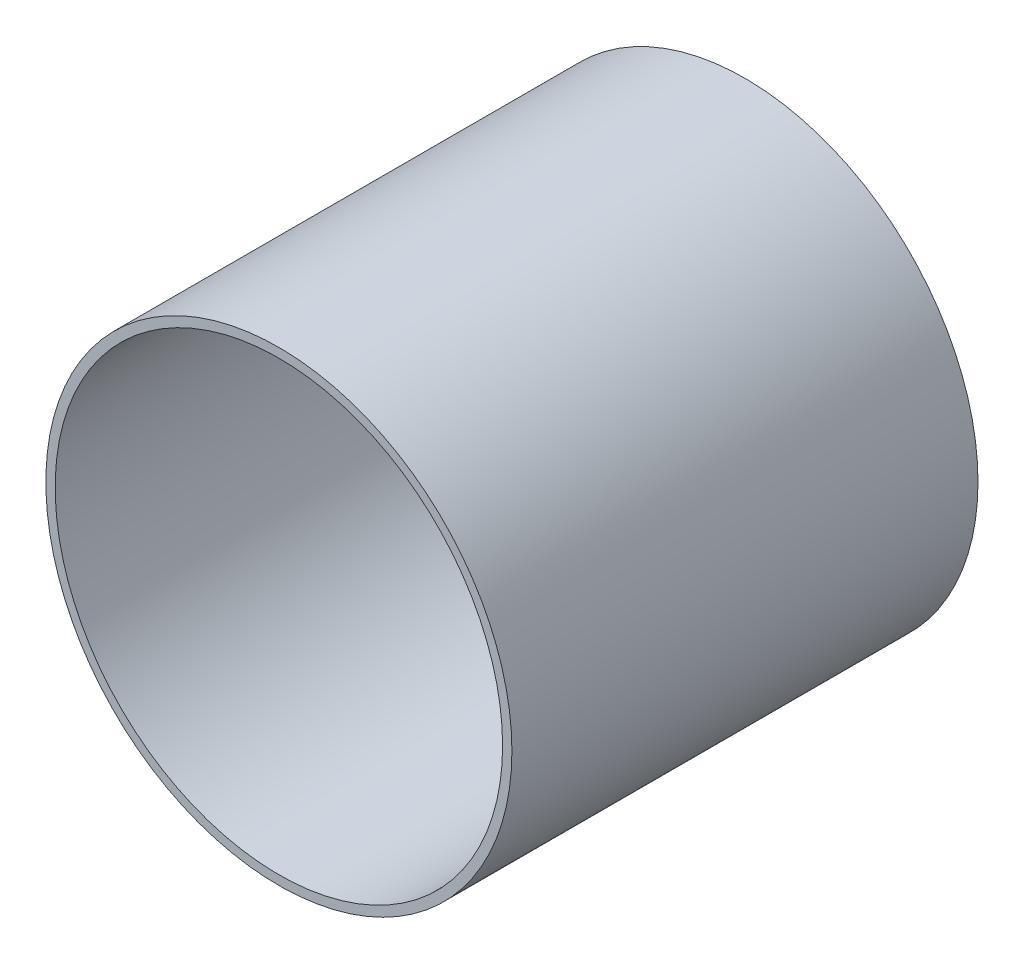
from build123d import *

# Parameters (mm, degrees)
SKETCH1_R           = 50
SKETCH1_R_2         = 48
BOSS_EXTRUDE1_DEPTH = 100


with BuildPart() as part:
    # Sketch1 → Boss-Extrude1 (new body)
    with BuildSketch(Plane.XY):
        Circle(SKETCH1_R)
        Circle(SKETCH1_R_2, mode=Mode.SUBTRACT)
    extrude(amount=BOSS_EXTRUDE1_DEPTH)


solid = part.part
